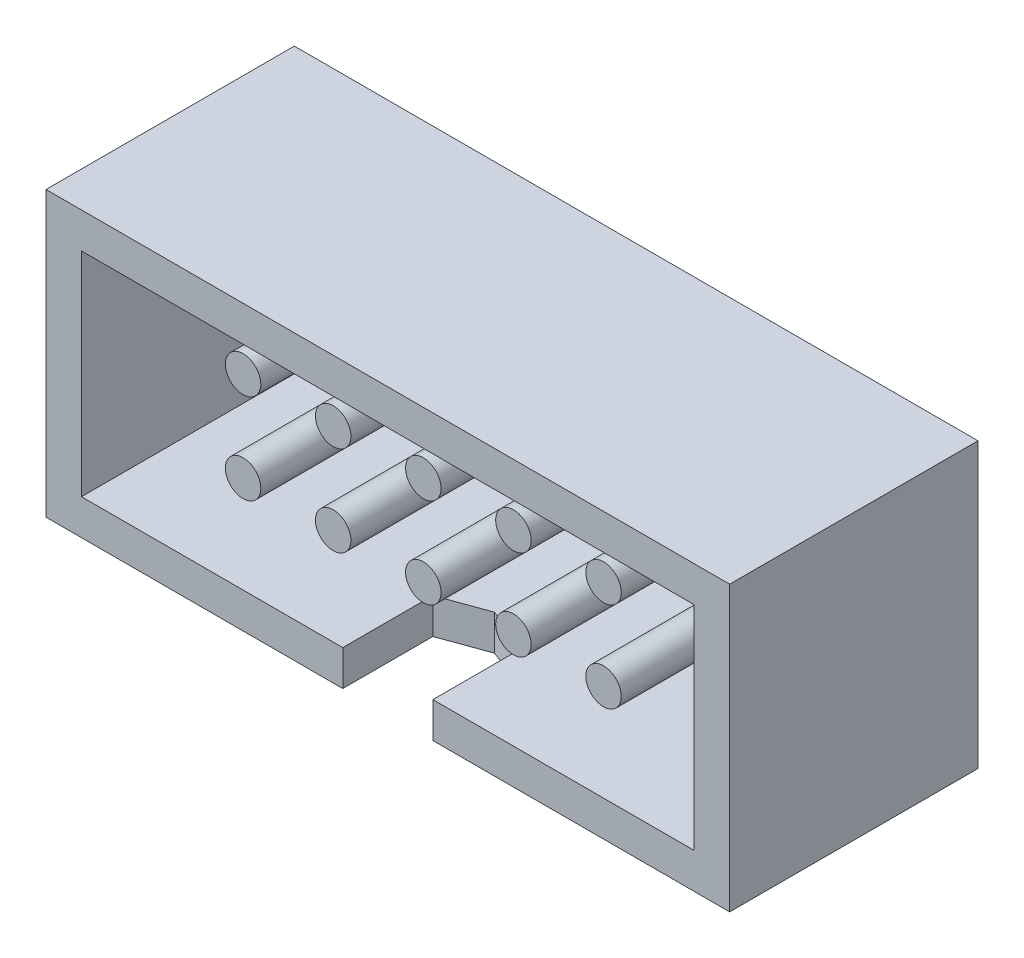
from build123d import *

# Parameters (mm, degrees)
SKETCH_1_W           = 19.27
SKETCH_1_H           = 8
EXTRUDE_1_DEPTH      = 7
SKETCH_2_W           = 17.27
SKETCH_2_H           = 6
CUT_EXTRUDE_1_DEPTH  = 6
CUT_EXTRUDE_2_REACH  = 24.008
EXTRUDE_2_DEPTH      = 5
EXTRUDE_2_DEPTH_BACK = 3
SKETCH_4_R           = 0.5


with BuildPart() as part:
    # 草图1 → 凸台-拉伸1 (new body)
    with BuildSketch(Plane.XY):
        with Locations((9.635, -4)):
            Rectangle(SKETCH_1_W, SKETCH_1_H)
    extrude(amount=EXTRUDE_1_DEPTH)

    # 草图2 → 切除-拉伸1 (cut)
    with BuildSketch(Plane.XY.offset(7)):
        with Locations((9.635, -4)):
            Rectangle(SKETCH_2_W, SKETCH_2_H)
    extrude(amount=-CUT_EXTRUDE_1_DEPTH, mode=Mode.SUBTRACT)

    # 草图3 → 切除-拉伸2 (cut, up to next)
    with BuildSketch(Plane.XZ.offset(8), mode=Mode.PRIVATE) as cut_extrude_2_sk1:
        Polygon((8.365, 7), (8.365, 4.46), (9.635, 4), (10.905, 4.46), (10.905, 7), align=None)
    cut_extrude_2_tool1 = extrude(cut_extrude_2_sk1.sketch, amount=-CUT_EXTRUDE_2_REACH, mode=Mode.PRIVATE) & part.part
    add(cut_extrude_2_tool1.solids().sort_by_distance((9.635, -8, 5.611817))[0], mode=Mode.SUBTRACT)

    # 草图4 → 凸台-拉伸2 (add, two sides: drawn at the far end of the back side and taken through both)
    with BuildSketch(Plane.XY.offset(1).offset(-EXTRUDE_2_DEPTH_BACK)):
        with Locations((9.635, -2.73)):
            Circle(SKETCH_4_R)
        with Locations((12.175, -2.73)):
            Circle(SKETCH_4_R)
        with Locations((14.715, -2.73)):
            Circle(SKETCH_4_R)
        with Locations(Location((4.555, -2.73, 0), (0, 0, 180))):
            Circle(SKETCH_4_R)
        with Locations(Location((7.095, -2.73, 0), (0, 0, 180))):
            Circle(SKETCH_4_R)
        with Locations(Location((14.715, -5.27, 0), (0, 0, 180))):
            Circle(SKETCH_4_R)
        with Locations(Location((12.175, -5.27, 0), (0, 0, 180))):
            Circle(SKETCH_4_R)
        with Locations(Location((9.635, -5.27, 0), (0, 0, 180))):
            Circle(SKETCH_4_R)
        with Locations((7.095, -5.27)):
            Circle(SKETCH_4_R)
        with Locations((4.555, -5.27)):
            Circle(SKETCH_4_R)
    extrude(amount=EXTRUDE_2_DEPTH + EXTRUDE_2_DEPTH_BACK)


solid = part.part
